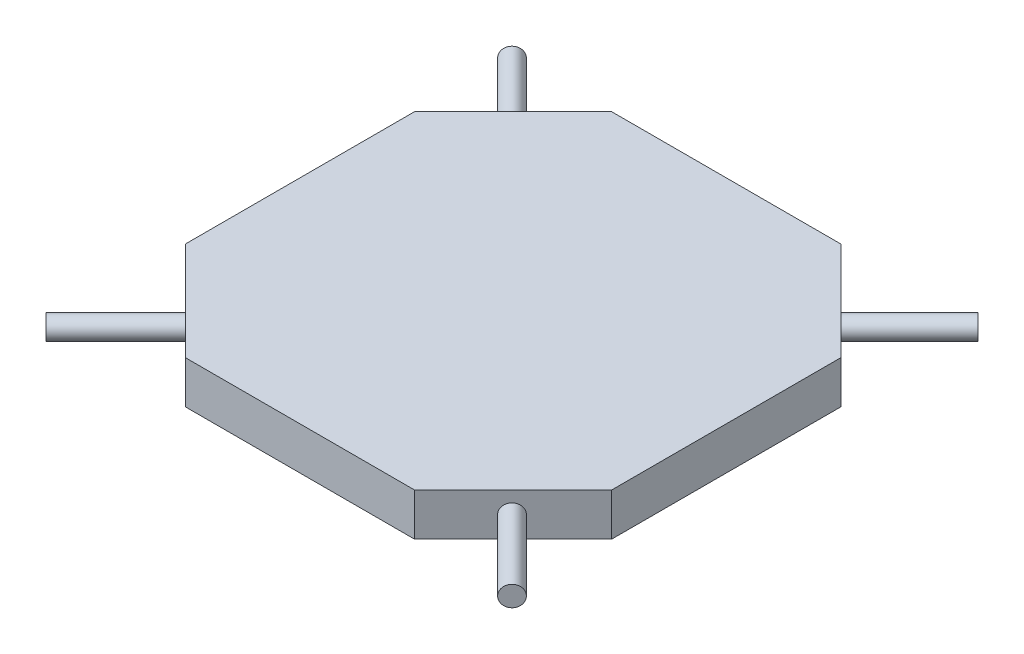
from build123d import *

# Parameters (mm, degrees)
BOSS_EXTRUDE1_DEPTH     = 5
SKETCH3_R               = 2.39
BOSS_EXTRUDE2_DEPTH     = 23.4
MIRROR3_COPY_1_SKETCH_R = 2.39
MIRROR3_COPY_1_DEPTH    = 23.4


with BuildPart() as part:
    # Sketch2 → Boss-Extrude1 (new, symmetric)
    with BuildSketch(Plane(origin=(0, 0, 0), x_dir=(1, 0, 0), z_dir=(0, 1, 0))):
        Polygon((-50.18902685, 27.340766285), (-50.18902685, -26.442734497), (-27.080777241, -49.550984106), (26.70272354, -49.550984106), (49.81097315, -26.442734497), (49.81097315, 27.340766285), (26.70272354, 50.449015894), (-27.080777241, 50.449015894), align=None)
    extrude(amount=BOSS_EXTRUDE1_DEPTH, both=True)

    # Sketch3 → Boss-Extrude2 (add)
    with BuildSketch(Plane(origin=(38.126853823, 0, 38.126853823), x_dir=(0.7071067811865475, 0, -0.7071067811865477), z_dir=(0.7071067811865477, 0, 0.7071067811865475))):
        Circle(SKETCH3_R)
    boss_extrude2 = extrude(amount=BOSS_EXTRUDE2_DEPTH)

    # Mirror2: Boss-Extrude2 across plane
    add(boss_extrude2.mirror(Plane(origin=(0, 0, 0), x_dir=(0, 0, 1), z_dir=(1, 0, 0))))

    # Mirror3: Boss-Extrude2 across plane
    add(boss_extrude2.mirror(Plane.XY))

    # Mirror3 copy 1 sketch → Mirror3 copy 1 (add)
    with BuildSketch(Plane(origin=(-38.126853823, 0, -38.126853823), x_dir=(-0.7071067811865475, 0, 0.7071067811865477), z_dir=(-0.7071067811865477, 0, -0.7071067811865475))):
        Circle(MIRROR3_COPY_1_SKETCH_R)
    extrude(amount=MIRROR3_COPY_1_DEPTH)


solid = part.part
